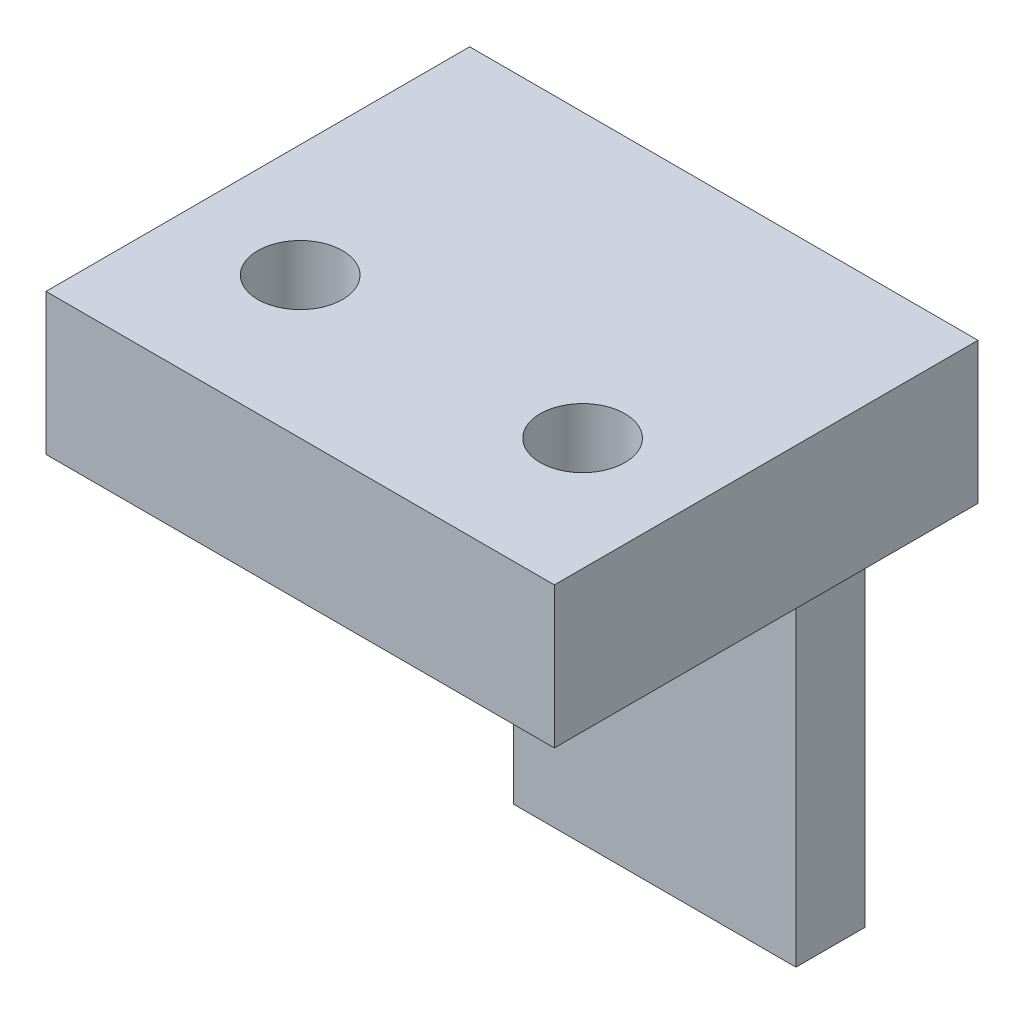
from build123d import *

# Parameters (mm, degrees)
SKETCH1_W           = 18
SKETCH1_H           = 10
SKETCH1_R           = 1.5
BOSS_EXTRUDE1_DEPTH = 5
SKETCH2_W           = 18
SKETCH2_H           = 5
BOSS_EXTRUDE2_DEPTH = 5
SKETCH3_W           = 10
SKETCH3_H           = 2.44730383
BOSS_EXTRUDE3_DEPTH = 15
BOSS_EXTRUDE5_DEPTH = 10


with BuildPart() as part:
    # Sketch1 → Boss-Extrude1 (new body)
    with BuildSketch(Plane(origin=(0, 0, 0), x_dir=(1, 0, 0), z_dir=(0, 1, 0))):
        Rectangle(SKETCH1_W, SKETCH1_H)
        with Locations(Location((-5, 0, 0), (0, 0, 270))):
            Circle(SKETCH1_R, mode=Mode.SUBTRACT)
        with Locations(Location((5, 0, 0), (0, 0, 270))):
            Circle(SKETCH1_R, mode=Mode.SUBTRACT)
    extrude(amount=BOSS_EXTRUDE1_DEPTH)

    # Sketch2 → Boss-Extrude2 (add)
    with BuildSketch(Plane(origin=(0, 0, -5), x_dir=(-1, 0, 0), z_dir=(0, 0, -1))):
        with Locations((0, 2.5)):
            Rectangle(SKETCH2_W, SKETCH2_H)
    extrude(amount=BOSS_EXTRUDE2_DEPTH)

    # Sketch3 → Boss-Extrude3 (add)
    with BuildSketch(Plane.XZ):
        with Locations((0, -8.776348085)):
            Rectangle(SKETCH3_W, SKETCH3_H)
    extrude(amount=BOSS_EXTRUDE3_DEPTH)

    # Sketch4 → Boss-Extrude5 (add)
    with BuildSketch(Plane(origin=(5, 0, 0), x_dir=(0, 0, -1), z_dir=(1, 0, 0))):
        with BuildLine():
            Line((4.55269617, 0), (7.55269617, 0))
            Line((7.55269617, 0), (7.55269617, -3))
            ThreePointArc((7.55269617, -3), (6.674016513, -0.878679656), (4.55269617, 0))
        make_face()
    extrude(amount=-BOSS_EXTRUDE5_DEPTH)


solid = part.part
